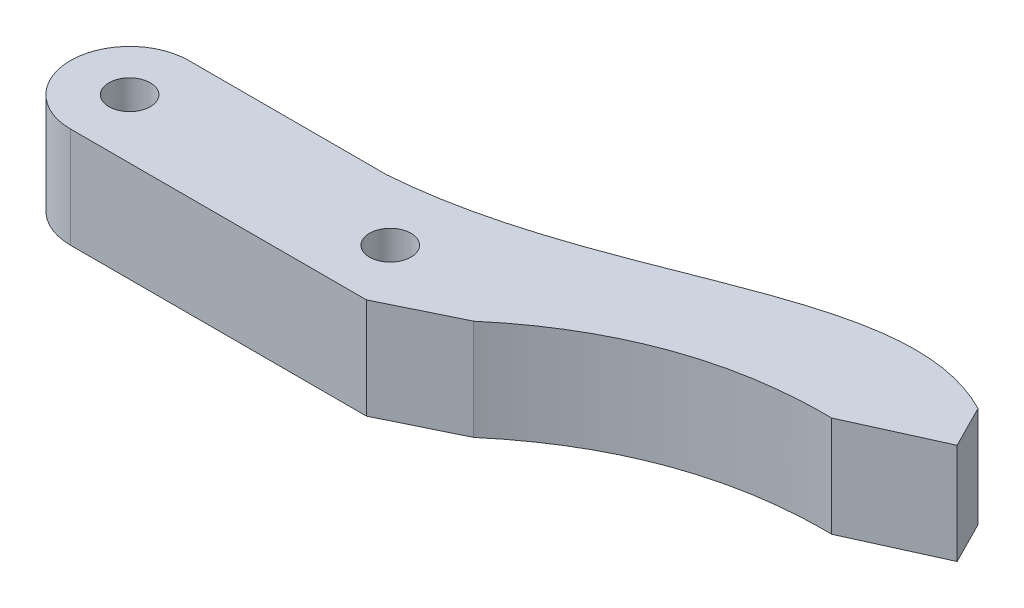
from build123d import *

# Parameters (mm, degrees)
SKETCH1_R           = 5
SKETCH1_R_2         = 1.75
BOSS_EXTRUDE1_DEPTH = 8.5
BOSS_EXTRUDE2_START = -8.5
BOSS_EXTRUDE2_DEPTH = 8.5


with BuildPart() as part:
    # Sketch1 → Boss-Extrude1 (new body)
    # profile 1 of 3: a face of its own
    with BuildSketch(Plane(origin=(0, 0, 0), x_dir=(1, 0, 0), z_dir=(0, 1, 0))):
        Circle(SKETCH1_R)
        with Locations(Location((0, 0, 0), (0, 0, 270))):
            Circle(SKETCH1_R_2, mode=Mode.SUBTRACT)
    # profile 2 of 3: a face of its own
    with BuildSketch(Plane(origin=(0, 0, 0), x_dir=(1, 0, 0), z_dir=(0, 1, 0))):
        with BuildLine():
            Line((22, 5), (0, 5))
            ThreePointArc((0, 5), (3.535533906, 3.535533906), (5, 0))
            ThreePointArc((5, 0), (3.535533907, -3.535533905), (3e-09, -5))
            Line((3e-09, -5), (22, -5))
            ThreePointArc((22, -5), (17, 0), (22, 5))
        make_face()
    # profile 3 of 3: a face of its own
    with BuildSketch(Plane(origin=(0, 0, 0), x_dir=(1, 0, 0), z_dir=(0, 1, 0))):
        with Locations((22, 0)):
            Circle(SKETCH1_R)
        with Locations(Location((22, 0, 0), (0, 0, 270))):
            Circle(SKETCH1_R_2, mode=Mode.SUBTRACT)
    extrude(amount=BOSS_EXTRUDE1_DEPTH)

    # Sketch2 → Boss-Extrude2 (add)
    with BuildSketch(Plane(origin=(0, 8.5, 0), x_dir=(1, 0, 0), z_dir=(0, 1, 0)).offset(BOSS_EXTRUDE2_START)):
        with BuildLine():
            ThreePointArc((22, 5), (27, 0), (22, -5))
            Line((22, -5), (24.99, -5))
            Line((24.99, -5), (31.08, -2.029708536))
            add(Edge.make_bspline(
                [(31.08, -2.029708536), (40.738723452, 6.188270814), (53.27, 6)],
                knots=[0, 0, 0, 1, 1, 1], degree=2))
            Line((53.27, 6), (60.557013712, 9.301428655))
            Line((60.557013712, 9.301428655), (58.75, 12.87))
            add(Edge.make_bspline(
                [(16.693950363, 5), (34.27932275, 6.303745675), (46.942612852, 18.996556194), (58.75, 12.87)],
                knots=[0.094833199, 0.094833199, 0.094833199, 0.094833199, 1, 1, 1, 1], degree=3))
            Line((16.693950363, 5), (22, 5))
        make_face()
    extrude(amount=BOSS_EXTRUDE2_DEPTH)


solid = part.part
